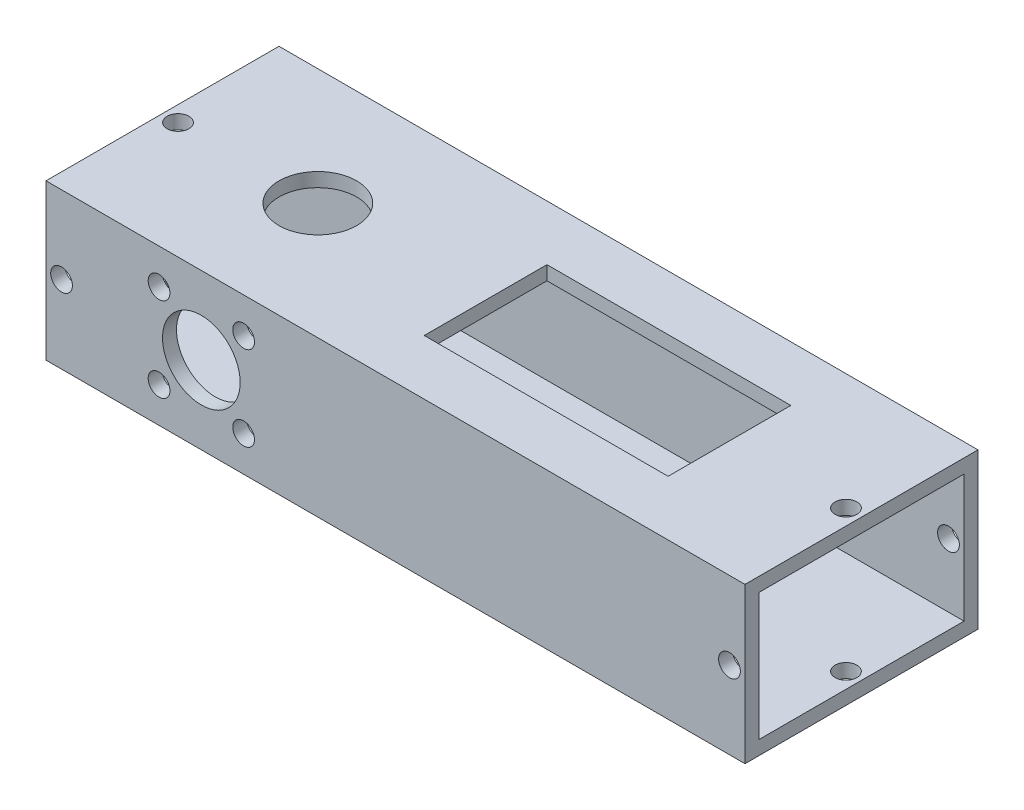
from build123d import *

# Parameters (mm, degrees)
SKETCH1_W           = 114.3
SKETCH1_H           = 38.1
BOSS_EXTRUDE1_DEPTH = 25.4
CUT_EXTRUDE1_REACH  = 125.131
SKETCH2_W           = 33.528
SKETCH2_H           = 20.828
CUT_EXTRUDE2_REACH  = 125.131
SKETCH3_R           = 1.778
CUT_EXTRUDE3_REACH  = 125.131
SKETCH4_R           = 1.778
CUT_EXTRUDE4_REACH  = 125.131
SKETCH5_R           = 1.778
SKETCH5_R_2         = 6.35
CUT_EXTRUDE5_REACH  = 125.131
SKETCH6_R           = 1.778
SKETCH6_R_2         = 6.35
CUT_EXTRUDE6_REACH  = 125.131
SKETCH7_R           = 1.778
SKETCH7_R_2         = 6.35
CUT_EXTRUDE7_REACH  = 125.131
SKETCH8_R           = 1.778
SKETCH8_R_2         = 6.35
CUT_EXTRUDE8_REACH  = 125.131
SKETCH9_R           = 1.778
CUT_EXTRUDE9_REACH  = 125.131
SKETCH10_R          = 1.778


with BuildPart() as part:
    # Sketch1 → Boss-Extrude1 (new body)
    with BuildSketch(Plane(origin=(0, 0, 0), x_dir=(1, 0, 0), z_dir=(0, 1, 0))):
        with Locations((-57.15, -19.05)):
            Rectangle(SKETCH1_W, SKETCH1_H)
    extrude(amount=BOSS_EXTRUDE1_DEPTH)

    # Sketch2 → Cut-Extrude1 (cut, up to next)
    with BuildSketch(Plane(origin=(0, 0, 0), x_dir=(0, 0, -1), z_dir=(1, 0, 0)), mode=Mode.PRIVATE) as cut_extrude1_sk1:
        with Locations((-19.05, 12.7)):
            Rectangle(SKETCH2_W, SKETCH2_H)
    cut_extrude1_tool1 = extrude(cut_extrude1_sk1.sketch, amount=-CUT_EXTRUDE1_REACH, mode=Mode.PRIVATE) & part.part
    add(cut_extrude1_tool1.solids().sort_by_distance((0, 12.7, 19.05))[0], mode=Mode.SUBTRACT)

    # Sketch3 → Cut-Extrude2 (cut, up to next)
    with BuildSketch(Plane.XY.offset(38.1), mode=Mode.PRIVATE) as cut_extrude2_sk1:
        with Locations((-2.54, 12.7)):
            Circle(SKETCH3_R)
    cut_extrude2_tool1 = extrude(cut_extrude2_sk1.sketch, amount=-CUT_EXTRUDE2_REACH, mode=Mode.PRIVATE) & part.part
    add(cut_extrude2_tool1.solids().sort_by_distance((-2.54, 12.7, 38.1))[0], mode=Mode.SUBTRACT)

    # Sketch4 → Cut-Extrude3 (cut, up to next)
    with BuildSketch(Plane(origin=(0, 0, 0), x_dir=(-1, 0, 0), z_dir=(0, 0, -1)), mode=Mode.PRIVATE) as cut_extrude3_sk1:
        with Locations(Location((2.54, 12.7, 0), (0, 0, 180))):
            Circle(SKETCH4_R)
    cut_extrude3_tool1 = extrude(cut_extrude3_sk1.sketch, amount=-CUT_EXTRUDE3_REACH, mode=Mode.PRIVATE) & part.part
    add(cut_extrude3_tool1.solids().sort_by_distance((-2.54, 12.7, 0))[0], mode=Mode.SUBTRACT)

    # Sketch5 → Cut-Extrude4 (cut, up to next)
    with BuildSketch(Plane.XY.offset(38.1), mode=Mode.PRIVATE) as cut_extrude4_sk1:
        with Locations((-111.76, 12.7)):
            Circle(SKETCH5_R)
    cut_extrude4_tool1 = extrude(cut_extrude4_sk1.sketch, amount=-CUT_EXTRUDE4_REACH, mode=Mode.PRIVATE) & part.part
    # Sketch5 → Cut-Extrude4 (cut, up to next)
    with BuildSketch(Plane.XY.offset(38.1), mode=Mode.PRIVATE) as cut_extrude4_sk2:
        with Locations((-88.9, 12.7)):
            Circle(SKETCH5_R_2)
    cut_extrude4_tool2 = extrude(cut_extrude4_sk2.sketch, amount=-CUT_EXTRUDE4_REACH, mode=Mode.PRIVATE) & part.part
    # Sketch5 → Cut-Extrude4 (cut, up to next)
    with BuildSketch(Plane.XY.offset(38.1), mode=Mode.PRIVATE) as cut_extrude4_sk3:
        with Locations((-95.814797213, 19.614797213)):
            Circle(SKETCH5_R)
    cut_extrude4_tool3 = extrude(cut_extrude4_sk3.sketch, amount=-CUT_EXTRUDE4_REACH, mode=Mode.PRIVATE) & part.part
    # Sketch5 → Cut-Extrude4 (cut, up to next)
    with BuildSketch(Plane.XY.offset(38.1), mode=Mode.PRIVATE) as cut_extrude4_sk4:
        with Locations((-81.985202787, 19.614797213)):
            Circle(SKETCH5_R)
    cut_extrude4_tool4 = extrude(cut_extrude4_sk4.sketch, amount=-CUT_EXTRUDE4_REACH, mode=Mode.PRIVATE) & part.part
    # Sketch5 → Cut-Extrude4 (cut, up to next)
    with BuildSketch(Plane.XY.offset(38.1), mode=Mode.PRIVATE) as cut_extrude4_sk5:
        with Locations((-95.814797213, 5.785202787)):
            Circle(SKETCH5_R)
    cut_extrude4_tool5 = extrude(cut_extrude4_sk5.sketch, amount=-CUT_EXTRUDE4_REACH, mode=Mode.PRIVATE) & part.part
    # Sketch5 → Cut-Extrude4 (cut, up to next)
    with BuildSketch(Plane.XY.offset(38.1), mode=Mode.PRIVATE) as cut_extrude4_sk6:
        with Locations((-81.985202787, 5.785202787)):
            Circle(SKETCH5_R)
    cut_extrude4_tool6 = extrude(cut_extrude4_sk6.sketch, amount=-CUT_EXTRUDE4_REACH, mode=Mode.PRIVATE) & part.part
    add(cut_extrude4_tool1.solids().sort_by_distance((-111.76, 12.7, 38.1))[0], mode=Mode.SUBTRACT)
    add(cut_extrude4_tool2.solids().sort_by_distance((-88.9, 12.7, 38.1))[0], mode=Mode.SUBTRACT)
    add(cut_extrude4_tool3.solids().sort_by_distance((-95.814797, 19.614797, 38.1))[0], mode=Mode.SUBTRACT)
    add(cut_extrude4_tool4.solids().sort_by_distance((-81.985203, 19.614797, 38.1))[0], mode=Mode.SUBTRACT)
    add(cut_extrude4_tool5.solids().sort_by_distance((-95.814797, 5.785203, 38.1))[0], mode=Mode.SUBTRACT)
    add(cut_extrude4_tool6.solids().sort_by_distance((-81.985203, 5.785203, 38.1))[0], mode=Mode.SUBTRACT)

    # Sketch6 → Cut-Extrude5 (cut, up to next)
    with BuildSketch(Plane(origin=(0, 0, 0), x_dir=(-1, 0, 0), z_dir=(0, 0, -1)), mode=Mode.PRIVATE) as cut_extrude5_sk1:
        with Locations(Location((111.76, 12.7, 0), (0, 0, 180))):
            Circle(SKETCH6_R)
    cut_extrude5_tool1 = extrude(cut_extrude5_sk1.sketch, amount=-CUT_EXTRUDE5_REACH, mode=Mode.PRIVATE) & part.part
    # Sketch6 → Cut-Extrude5 (cut, up to next)
    with BuildSketch(Plane(origin=(0, 0, 0), x_dir=(-1, 0, 0), z_dir=(0, 0, -1)), mode=Mode.PRIVATE) as cut_extrude5_sk2:
        with Locations(Location((88.9, 12.7, 0), (0, 0, 180))):
            Circle(SKETCH6_R_2)
    cut_extrude5_tool2 = extrude(cut_extrude5_sk2.sketch, amount=-CUT_EXTRUDE5_REACH, mode=Mode.PRIVATE) & part.part
    # Sketch6 → Cut-Extrude5 (cut, up to next)
    with BuildSketch(Plane(origin=(0, 0, 0), x_dir=(-1, 0, 0), z_dir=(0, 0, -1)), mode=Mode.PRIVATE) as cut_extrude5_sk3:
        with Locations(Location((81.985202787, 19.614797213, 0), (0, 0, 180))):
            Circle(SKETCH6_R)
    cut_extrude5_tool3 = extrude(cut_extrude5_sk3.sketch, amount=-CUT_EXTRUDE5_REACH, mode=Mode.PRIVATE) & part.part
    # Sketch6 → Cut-Extrude5 (cut, up to next)
    with BuildSketch(Plane(origin=(0, 0, 0), x_dir=(-1, 0, 0), z_dir=(0, 0, -1)), mode=Mode.PRIVATE) as cut_extrude5_sk4:
        with Locations(Location((95.814797213, 19.614797213, 0), (0, 0, 180))):
            Circle(SKETCH6_R)
    cut_extrude5_tool4 = extrude(cut_extrude5_sk4.sketch, amount=-CUT_EXTRUDE5_REACH, mode=Mode.PRIVATE) & part.part
    # Sketch6 → Cut-Extrude5 (cut, up to next)
    with BuildSketch(Plane(origin=(0, 0, 0), x_dir=(-1, 0, 0), z_dir=(0, 0, -1)), mode=Mode.PRIVATE) as cut_extrude5_sk5:
        with Locations(Location((95.814797213, 5.785202787, 0), (0, 0, 180))):
            Circle(SKETCH6_R)
    cut_extrude5_tool5 = extrude(cut_extrude5_sk5.sketch, amount=-CUT_EXTRUDE5_REACH, mode=Mode.PRIVATE) & part.part
    # Sketch6 → Cut-Extrude5 (cut, up to next)
    with BuildSketch(Plane(origin=(0, 0, 0), x_dir=(-1, 0, 0), z_dir=(0, 0, -1)), mode=Mode.PRIVATE) as cut_extrude5_sk6:
        with Locations(Location((81.985202787, 5.785202787, 0), (0, 0, 180))):
            Circle(SKETCH6_R)
    cut_extrude5_tool6 = extrude(cut_extrude5_sk6.sketch, amount=-CUT_EXTRUDE5_REACH, mode=Mode.PRIVATE) & part.part
    add(cut_extrude5_tool1.solids().sort_by_distance((-111.76, 12.7, 0))[0], mode=Mode.SUBTRACT)
    add(cut_extrude5_tool2.solids().sort_by_distance((-88.9, 12.7, 0))[0], mode=Mode.SUBTRACT)
    add(cut_extrude5_tool3.solids().sort_by_distance((-81.985203, 19.614797, 0))[0], mode=Mode.SUBTRACT)
    add(cut_extrude5_tool4.solids().sort_by_distance((-95.814797, 19.614797, 0))[0], mode=Mode.SUBTRACT)
    add(cut_extrude5_tool5.solids().sort_by_distance((-95.814797, 5.785203, 0))[0], mode=Mode.SUBTRACT)
    add(cut_extrude5_tool6.solids().sort_by_distance((-81.985203, 5.785203, 0))[0], mode=Mode.SUBTRACT)

    # Sketch7 → Cut-Extrude6 (cut, up to next)
    with BuildSketch(Plane(origin=(0, 25.4, 0), x_dir=(1, 0, 0), z_dir=(0, 1, 0)), mode=Mode.PRIVATE) as cut_extrude6_sk1:
        with Locations(Location((-111.76, -19.05, 0), (0, 0, 270))):
            Circle(SKETCH7_R)
    cut_extrude6_tool1 = extrude(cut_extrude6_sk1.sketch, amount=-CUT_EXTRUDE6_REACH, mode=Mode.PRIVATE) & part.part
    # Sketch7 → Cut-Extrude6 (cut, up to next)
    with BuildSketch(Plane(origin=(0, 25.4, 0), x_dir=(1, 0, 0), z_dir=(0, 1, 0)), mode=Mode.PRIVATE) as cut_extrude6_sk2:
        with Locations(Location((-88.9, -19.05, 0), (0, 0, 270))):
            Circle(SKETCH7_R_2)
    cut_extrude6_tool2 = extrude(cut_extrude6_sk2.sketch, amount=-CUT_EXTRUDE6_REACH, mode=Mode.PRIVATE) & part.part
    # Sketch7 → Cut-Extrude6 (cut, up to next)
    with BuildSketch(Plane(origin=(0, 25.4, 0), x_dir=(1, 0, 0), z_dir=(0, 1, 0)), mode=Mode.PRIVATE) as cut_extrude6_sk3:
        Polygon((-61.468, -19.05), (-61.468, -9.017), (-21.59, -9.017), (-21.59, -29.083), (-61.468, -29.083), align=None)
    cut_extrude6_tool3 = extrude(cut_extrude6_sk3.sketch, amount=-CUT_EXTRUDE6_REACH, mode=Mode.PRIVATE) & part.part
    add(cut_extrude6_tool1.solids().sort_by_distance((-111.76, 25.4, 19.05))[0], mode=Mode.SUBTRACT)
    add(cut_extrude6_tool2.solids().sort_by_distance((-88.9, 25.4, 19.05))[0], mode=Mode.SUBTRACT)
    add(cut_extrude6_tool3.solids().sort_by_distance((-41.529, 25.4, 19.05))[0], mode=Mode.SUBTRACT)

    # Sketch8 → Cut-Extrude7 (cut, up to next)
    with BuildSketch(Plane.XZ, mode=Mode.PRIVATE) as cut_extrude7_sk1:
        with Locations(Location((-111.76, 19.05, 0), (0, 0, 90))):
            Circle(SKETCH8_R)
    cut_extrude7_tool1 = extrude(cut_extrude7_sk1.sketch, amount=-CUT_EXTRUDE7_REACH, mode=Mode.PRIVATE) & part.part
    # Sketch8 → Cut-Extrude7 (cut, up to next)
    with BuildSketch(Plane.XZ, mode=Mode.PRIVATE) as cut_extrude7_sk2:
        with Locations(Location((-88.9, 19.05, 0), (0, 0, 90))):
            Circle(SKETCH8_R_2)
    cut_extrude7_tool2 = extrude(cut_extrude7_sk2.sketch, amount=-CUT_EXTRUDE7_REACH, mode=Mode.PRIVATE) & part.part
    # Sketch8 → Cut-Extrude7 (cut, up to next)
    with BuildSketch(Plane.XZ, mode=Mode.PRIVATE) as cut_extrude7_sk3:
        Polygon((-61.468, 19.05), (-61.468, 29.083), (-21.59, 29.083), (-21.59, 9.017), (-61.468, 9.017), align=None)
    cut_extrude7_tool3 = extrude(cut_extrude7_sk3.sketch, amount=-CUT_EXTRUDE7_REACH, mode=Mode.PRIVATE) & part.part
    add(cut_extrude7_tool1.solids().sort_by_distance((-111.76, 0, 19.05))[0], mode=Mode.SUBTRACT)
    add(cut_extrude7_tool2.solids().sort_by_distance((-88.9, 0, 19.05))[0], mode=Mode.SUBTRACT)
    add(cut_extrude7_tool3.solids().sort_by_distance((-41.529, 0, 19.05))[0], mode=Mode.SUBTRACT)

    # Sketch9 → Cut-Extrude8 (cut, up to next)
    with BuildSketch(Plane(origin=(0, 25.4, 0), x_dir=(1, 0, 0), z_dir=(0, 1, 0)), mode=Mode.PRIVATE) as cut_extrude8_sk1:
        with Locations(Location((-2.54, -19.05, 0), (0, 0, 270))):
            Circle(SKETCH9_R)
    cut_extrude8_tool1 = extrude(cut_extrude8_sk1.sketch, amount=-CUT_EXTRUDE8_REACH, mode=Mode.PRIVATE) & part.part
    add(cut_extrude8_tool1.solids().sort_by_distance((-2.54, 25.4, 19.05))[0], mode=Mode.SUBTRACT)

    # Sketch10 → Cut-Extrude9 (cut, up to next)
    with BuildSketch(Plane(origin=(0, 0, 0), x_dir=(-1, 0, 0), z_dir=(0, -1, 0)), mode=Mode.PRIVATE) as cut_extrude9_sk1:
        with Locations(Location((2.54, -19.05, 0), (0, 0, 270))):
            Circle(SKETCH10_R)
    cut_extrude9_tool1 = extrude(cut_extrude9_sk1.sketch, amount=-CUT_EXTRUDE9_REACH, mode=Mode.PRIVATE) & part.part
    add(cut_extrude9_tool1.solids().sort_by_distance((-2.54, 0, 19.05))[0], mode=Mode.SUBTRACT)


solid = part.part
